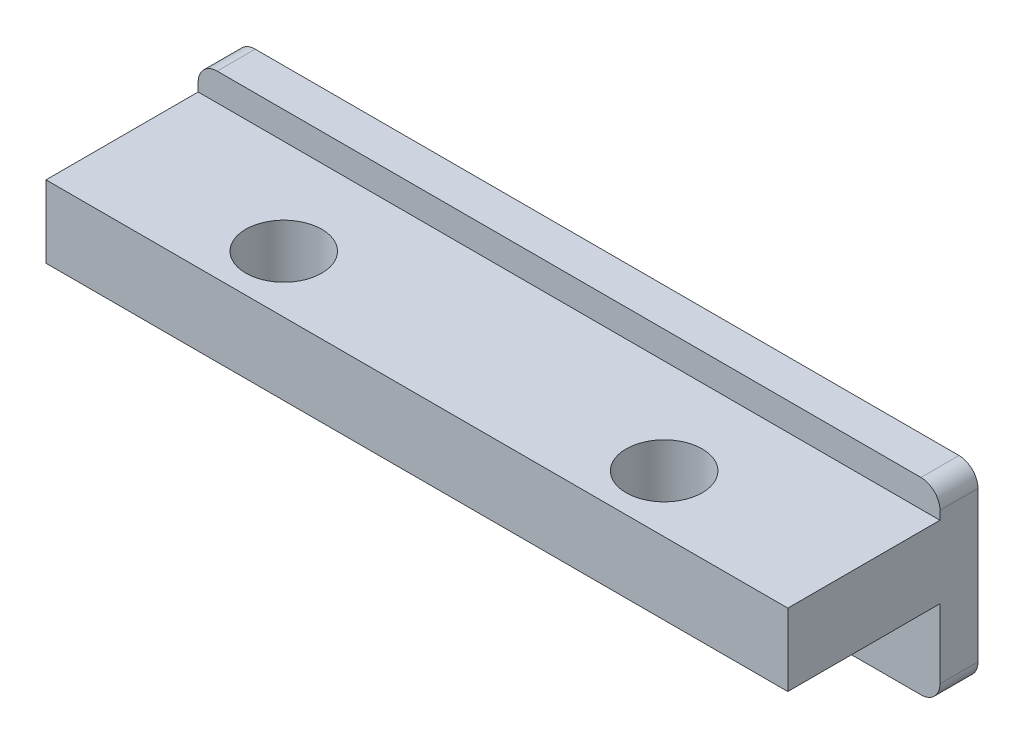
from build123d import *

# Parameters (mm, degrees)
BOSS_EXTRU_1_DEPTH           = 2
ESQUISSE2_W                  = 39
ESQUISSE2_H                  = 3.8
BOSS_EXTRU_2_DEPTH           = 8
ENL_V_MAT_EXTRU_1_DEPTH      = 41.602493766
ENL_V_MAT_EXTRU_1_DEPTH_BACK = 41.602493766
ESQUISSE3_R                  = 2
CONG_1_R                     = 1


with BuildPart() as part:
    # Esquisse1 → Boss.-Extru.1 (new body)
    with BuildSketch(Plane.XY):
        Polygon((0, 0), (0, 6.9), (39, 6.9), (39, 0), (39, -3), (29, -3), (29, 0), (10, 0), (10, -3), (0, -3), align=None)
    extrude(amount=BOSS_EXTRU_1_DEPTH)

    # Esquisse2 → Boss.-Extru.2 (add)
    with BuildSketch(Plane.XY.offset(2)):
        with Locations((19.5, 3.55)):
            Rectangle(ESQUISSE2_W, ESQUISSE2_H)
    extrude(amount=BOSS_EXTRU_2_DEPTH)

    # Esquisse3 → Enlèv. mat.-Extru.1 (cut, two sides: drawn at the far end of the back side and taken through both)
    with BuildSketch(Plane(origin=(0, 1.65, 0), x_dir=(1, 0, 0), z_dir=(0, 1, 0)).offset(-ENL_V_MAT_EXTRU_1_DEPTH_BACK)):
        with Locations(Location((9.5, -7, 0), (0, 0, 180))):
            Circle(ESQUISSE3_R)
        with Locations(Location((29.5, -7, 0), (0, 0, 180))):
            Circle(ESQUISSE3_R)
    extrude(amount=ENL_V_MAT_EXTRU_1_DEPTH + ENL_V_MAT_EXTRU_1_DEPTH_BACK, mode=Mode.SUBTRACT)

    # Congé1
    cong_1_edges = [part.edges().sort_by_distance(p)[0] for p in [
        (0, 6.9, 1),
        (39, 6.9, 1),
        (39, -3, 1),
        (29, -3, 1),
        (29, 0, 1),
        (10, 0, 1),
        (10, -3, 1),
        (0, -3, 1),
    ]]
    fillet(cong_1_edges, radius=CONG_1_R)


solid = part.part
